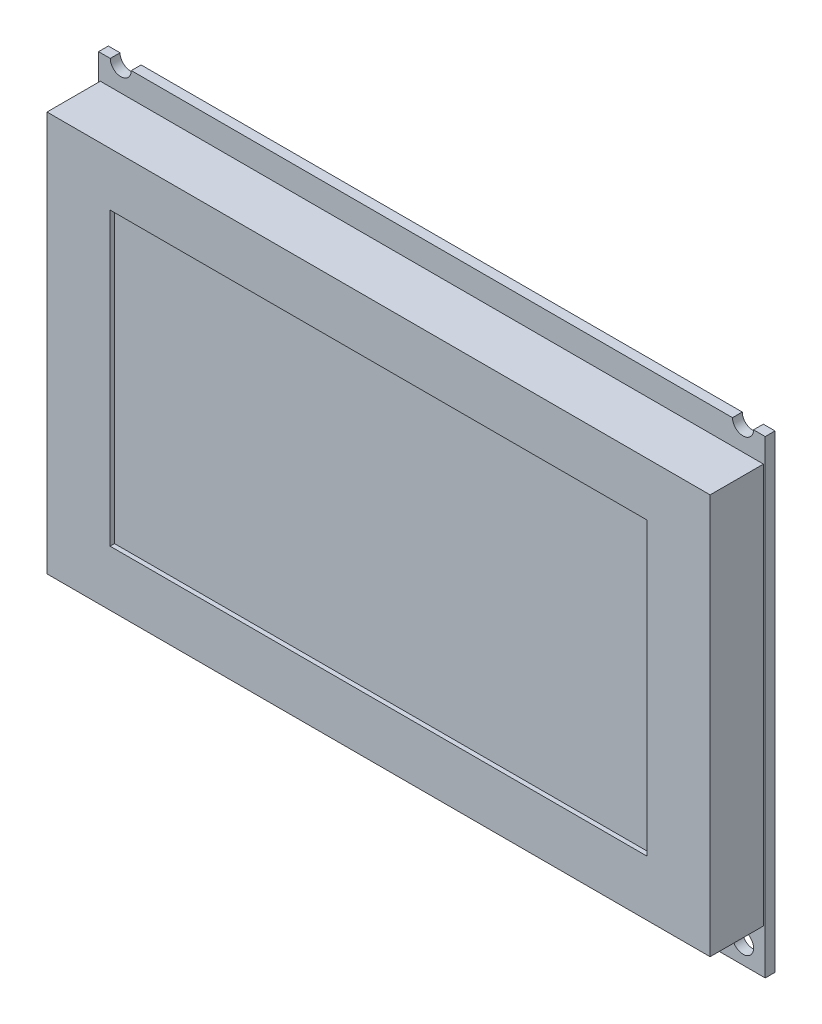
from build123d import *

# Parameters (mm, degrees)
SKETCH1_W           = 75
SKETCH1_H           = 52.75
BOSS_EXTRUDE1_DEPTH = 1.1
SKETCH2_R           = 1.185
CUT_EXTRUDE1_DEPTH  = 46.859575063
SKETCH3_W           = 74.6
SKETCH3_H           = 45
BOSS_EXTRUDE2_DEPTH = 6
SKETCH4_W           = 60.4
SKETCH4_H           = 32.75
CUT_EXTRUDE2_DEPTH  = 0.5


with BuildPart() as part:
    # Sketch1 → Boss-Extrude1 (new body)
    with BuildSketch(Plane.XY):
        Rectangle(SKETCH1_W, SKETCH1_H)
    extrude(amount=BOSS_EXTRUDE1_DEPTH)

    # Sketch2 → Cut-Extrude1 (cut, through all)
    with BuildSketch(Plane.XY.offset(1.1)):
        with Locations((-35, -24.125)):
            Circle(SKETCH2_R)
        with Locations((35, -24.125)):
            Circle(SKETCH2_R)
        with Locations((35, 26.375)):
            Circle(SKETCH2_R)
        with Locations((-35, 26.375)):
            Circle(SKETCH2_R)
    extrude(amount=-CUT_EXTRUDE1_DEPTH, mode=Mode.SUBTRACT)

    # Sketch3 → Boss-Extrude2 (add)
    with BuildSketch(Plane.XY.offset(1.1)):
        with Locations((0, 1.095)):
            Rectangle(SKETCH3_W, SKETCH3_H)
    extrude(amount=BOSS_EXTRUDE2_DEPTH)

    # Sketch4 → Cut-Extrude2 (cut)
    with BuildSketch(Plane.XY.offset(7.1)):
        with Locations((0, 1.22)):
            Rectangle(SKETCH4_W, SKETCH4_H)
    extrude(amount=-CUT_EXTRUDE2_DEPTH, mode=Mode.SUBTRACT)


solid = part.part
